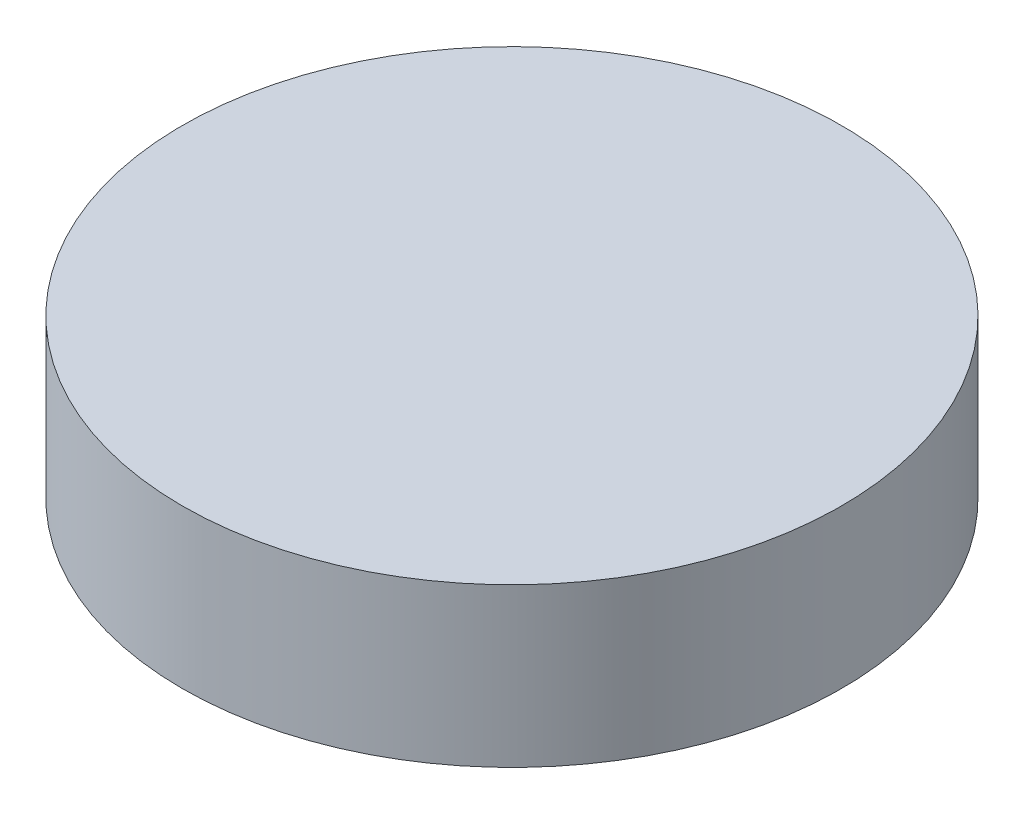
from build123d import *

# Parameters (mm, degrees)
SKETCH1_R                  = 25
TOPPING_AYAR_AYAGI_4_DEPTH = 12


with BuildPart() as part:
    # Sketch1 → TOPPING_ayar_ayagi_4 (new body)
    with BuildSketch(Plane(origin=(0, 0, 0), x_dir=(1, 0, 0), z_dir=(0, 1, 0))):
        with Locations(Location((650, 770, 0), (0, 0, 270))):
            Circle(SKETCH1_R)
    extrude(amount=TOPPING_AYAR_AYAGI_4_DEPTH)


solid = part.part
